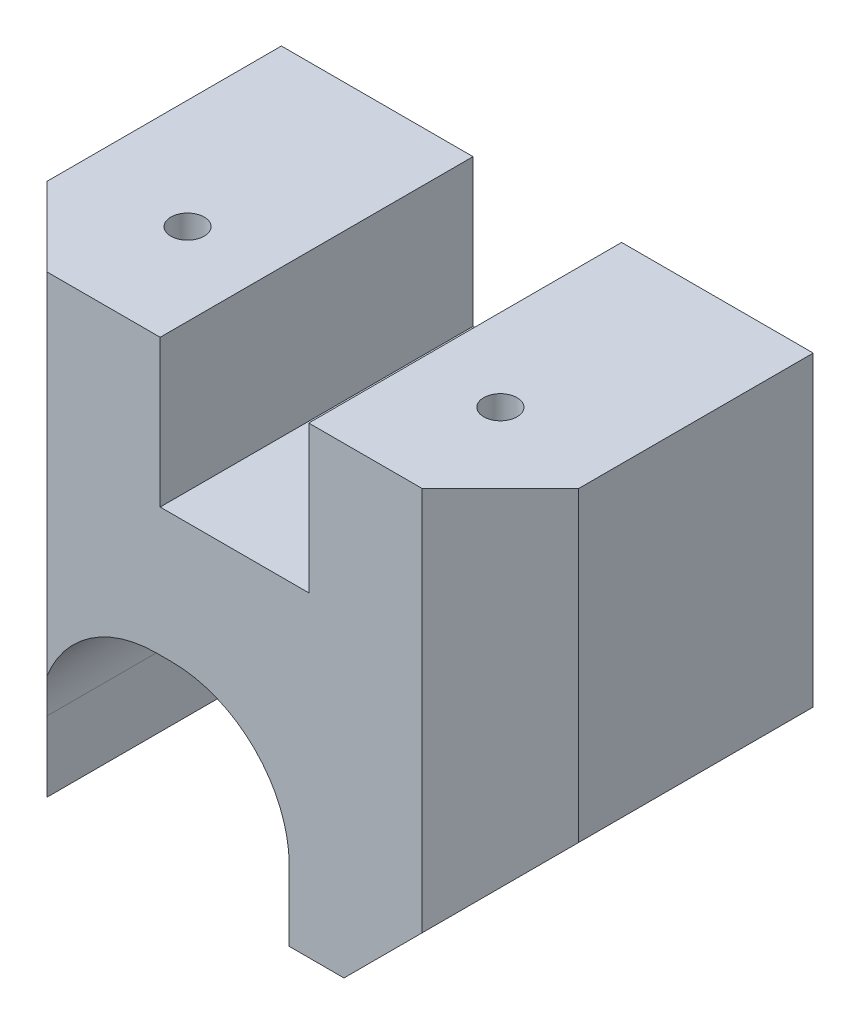
from build123d import *

# Parameters (mm, degrees)
SKETCH1_W                 = 43.18
SKETCH1_H                 = 25.4
BASE_DEPTH                = 37.592
SIDECHAMFER_SIZE          = 12.7
BACKCHAMFERS_SIZE         = 6.35
SKETCH2_W                 = 12.065
SKETCH2_H                 = 11.938
LINACTSLOT_DEPTH          = 51.24387091
MOUTINGHOLES_D            = 2.7051
MOUTINGHOLES_DEPTH        = 14.478
MOUTINGHOLES_TIP          = 0.81269403
MOTORSLOT_DEPTH           = 51.24387091
MOTORMOUNTINGHOLES2_D     = 2.2606
MOTORMOUNTINGHOLES2_DEPTH = 11.43
MOTORMOUNTINGHOLES2_TIP   = 0.679152758


with BuildPart() as part:
    # Sketch1 → Base (new body)
    with BuildSketch(Plane(origin=(0, 0, 0), x_dir=(1, 0, 0), z_dir=(0, 1, 0))):
        Rectangle(SKETCH1_W, SKETCH1_H)
    extrude(amount=BASE_DEPTH)

    # SideChamfer
    sidechamfer_edges = [part.edges().sort_by_distance(p)[0] for p in [
        (21.59, 0, 0),
    ]]
    chamfer(sidechamfer_edges, length=SIDECHAMFER_SIZE)

    # BackChamfers
    backchamfers_edges = [part.edges().sort_by_distance(p)[0] for p in [
        (21.59, 25.146, 12.7),
        (-21.59, 18.796, 12.7),
    ]]
    chamfer(backchamfers_edges, length=BACKCHAMFERS_SIZE)

    # Sketch2 → LinActSlot (cut, through all)
    with BuildSketch(Plane.XY.offset(12.7)):
        with Locations((0, 31.623)):
            Rectangle(SKETCH2_W, SKETCH2_H)
    extrude(amount=-LINACTSLOT_DEPTH, mode=Mode.SUBTRACT)

    # MoutingHoles
    with Locations(Plane(origin=(14.160350453, 37.592, 8.373414988), x_dir=(-1, 0, 0), z_dir=(0, 1, 0))):
        with Locations((1.460350453, -4.563414988), (26.860350453, -4.563414988)):
            Hole(MOUTINGHOLES_D / 2, depth=MOUTINGHOLES_DEPTH)
            with Locations((0, 0, -(MOUTINGHOLES_DEPTH + MOUTINGHOLES_TIP / 2))):  # 118° drill point
                Cone(0, MOUTINGHOLES_D / 2, MOUTINGHOLES_TIP, mode=Mode.SUBTRACT)

    # Sketch11 → MotorSlot (cut, through all)
    with BuildSketch(Plane(origin=(0, 0, -12.7), x_dir=(-1, 0, 0), z_dir=(0, 0, -1))):
        with BuildLine():
            Line((15.875, 5.08), (15.875, 5.715))
            ThreePointArc((15.875, 5.715), (13.085192091, 12.450192091), (6.35, 15.24))
            Line((6.35, 15.24), (5.08, 15.24))
            ThreePointArc((5.08, 15.24), (-1.655192091, 12.450192091), (-4.445, 5.715))
            Line((-4.445, 5.715), (-4.445, 5.08))
            Line((-4.445, 5.08), (-4.445, 0))
            Line((-4.445, 0), (15.875, 0))
            Line((15.875, 0), (15.875, 5.08))
        make_face()
    extrude(amount=-MOTORSLOT_DEPTH, mode=Mode.SUBTRACT)

    # MotorMountingHoles2
    with Locations(Plane(origin=(0, 0, -12.7), x_dir=(-1, 0, 0), z_dir=(0, 0, -1))):
        with Locations((18.215, 5.715), (-6.785, 5.715)):
            Hole(MOTORMOUNTINGHOLES2_D / 2, depth=MOTORMOUNTINGHOLES2_DEPTH)
            with Locations((0, 0, -(MOTORMOUNTINGHOLES2_DEPTH + MOTORMOUNTINGHOLES2_TIP / 2))):  # 118° drill point
                Cone(0, MOTORMOUNTINGHOLES2_D / 2, MOTORMOUNTINGHOLES2_TIP, mode=Mode.SUBTRACT)


solid = part.part
